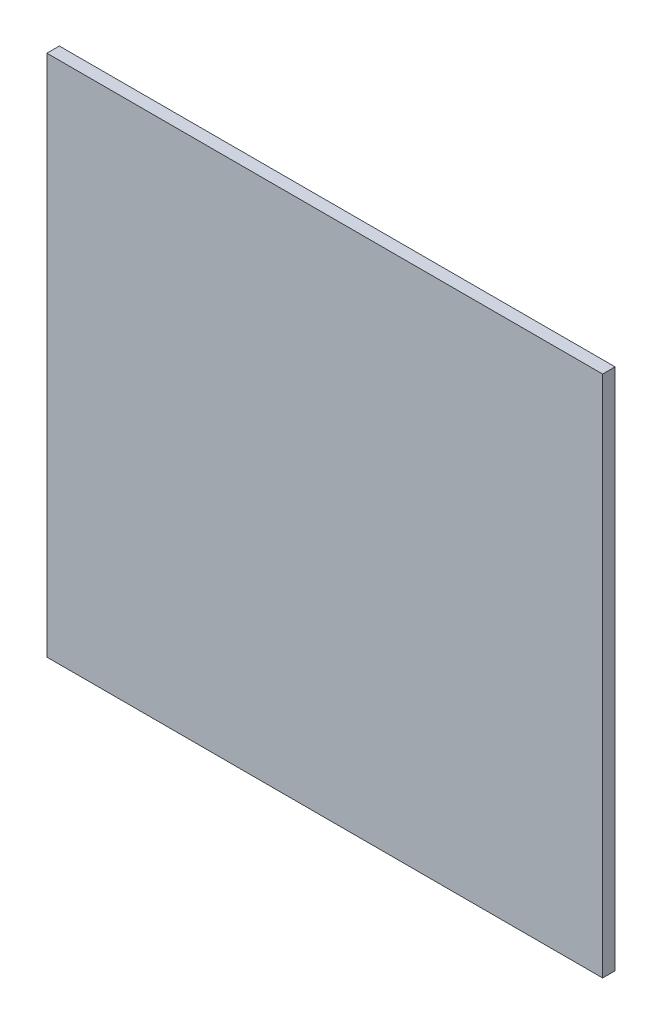
from build123d import *

# Parameters (mm, degrees)
ESQUISSE1_W        = 850
ESQUISSE1_H        = 800
BOSS_EXTRU_1_DEPTH = 19.05


with BuildPart() as part:
    # Esquisse1 → Boss.-Extru.1 (new body)
    with BuildSketch(Plane.XY):
        with Locations((395.844309516, -379.849137931)):
            Rectangle(ESQUISSE1_W, ESQUISSE1_H)
    extrude(amount=BOSS_EXTRU_1_DEPTH)


solid = part.part
